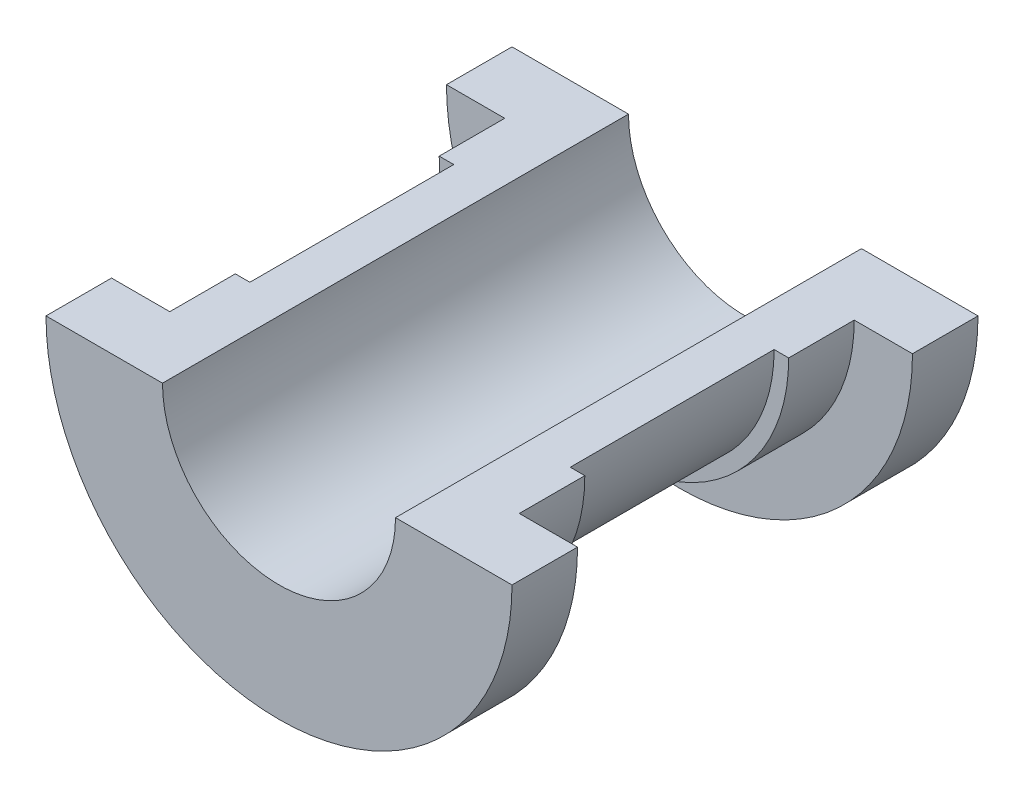
from build123d import *

# Parameters (mm, degrees)
SKETCH1_R           = 22
SKETCH1_R_2         = 16
BOSS_EXTRUDE2_DEPTH = 7
SKETCH3_R           = 24
BOSS_EXTRUDE6_DEPTH = 9
SKETCH6_R           = 32
BOSS_EXTRUDE7_DEPTH = 9
SKETCH7_R           = 16
CUT_EXTRUDE2_DEPTH  = 56.425625842
CUT_EXTRUDE3_DEPTH  = 79.383671769


with BuildPart() as part:
    # Sketch1 → Boss-Extrude2 (new, symmetric)
    with BuildSketch(Plane.XY):
        Circle(SKETCH1_R)
        Circle(SKETCH1_R_2, mode=Mode.SUBTRACT)
    extrude(amount=BOSS_EXTRUDE2_DEPTH, both=True)

    # Sketch3 → Boss-Extrude6 (add)
    with BuildSketch(Plane.XY.offset(7)):
        Circle(SKETCH3_R)
    extrude(amount=BOSS_EXTRUDE6_DEPTH)

    # Sketch6 → Boss-Extrude7 (add)
    with BuildSketch(Plane.XY.offset(16)):
        Circle(SKETCH6_R)
    extrude(amount=BOSS_EXTRUDE7_DEPTH)

    # Sketch7 → Cut-Extrude2 (cut, through all)
    with BuildSketch(Plane(origin=(0, 0, -7), x_dir=(-1, 0, 0), z_dir=(0, 0, -1))):
        Circle(SKETCH7_R)
    extrude(amount=-CUT_EXTRUDE2_DEPTH, mode=Mode.SUBTRACT)

    # Mirror3: part across plane


with BuildPart() as part_1:
    add(part.part)
    add(part.part.mirror(Plane.XY.offset(-7)))

    # Sketch8 → Cut-Extrude3 (cut, through all)
    with BuildSketch(Plane.XY.offset(25)):
        Polygon((-194.543052514, 0), (-35.372068519, 0), (34.570182834, 0), (193.741166829, 0), (193.741166829, 318.34196799), (-194.543052514, 318.34196799), align=None)
    extrude(amount=-CUT_EXTRUDE3_DEPTH, mode=Mode.SUBTRACT)


solid = part_1.part
